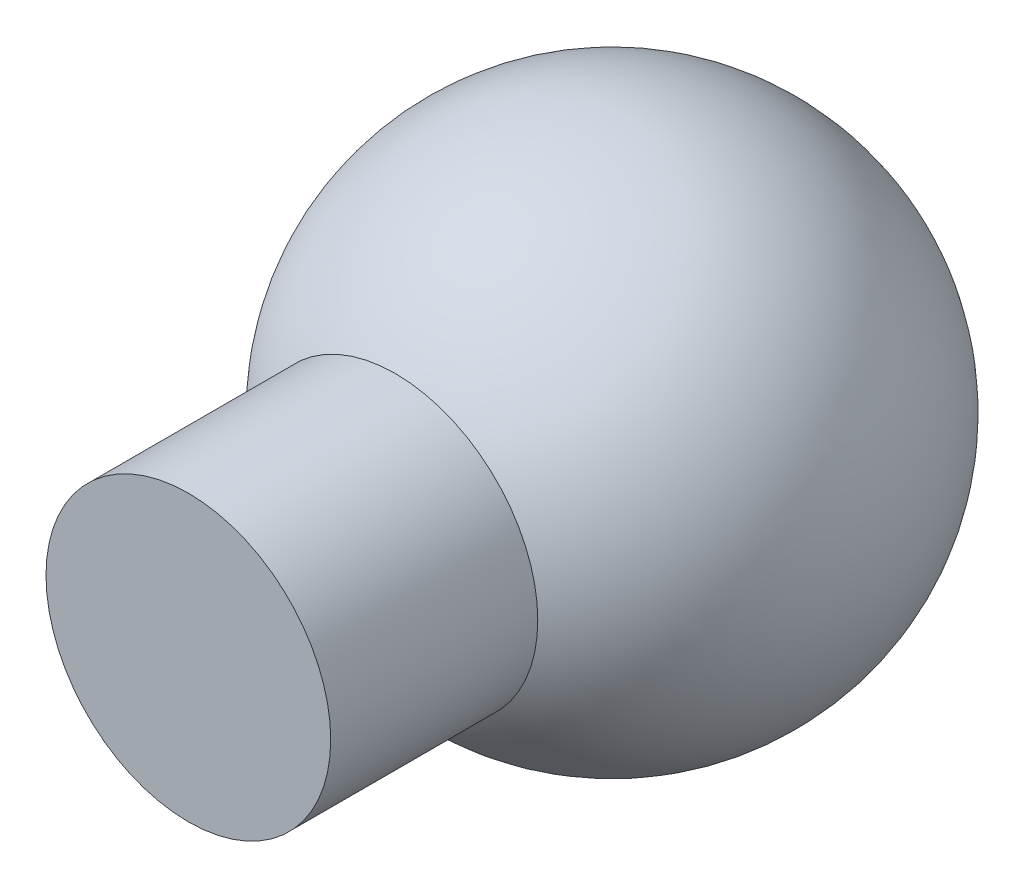
from build123d import *

# Parameters (mm, degrees)
SKETCH_1_R          = 5.5
EXTRUDE_1_DEPTH     = 15
SKETCH_3_R          = 7.159544481
CUT_EXTRUDE_1_DEPTH = 7


with BuildPart() as part:
    # 스케치1 → 보스-돌출1 (new body)
    with BuildSketch(Plane.XY):
        Circle(SKETCH_1_R)
    extrude(amount=EXTRUDE_1_DEPTH)

    # 스케치2 → 회전1 (revolve)
    with BuildSketch(Plane(origin=(0, 0, 0), x_dir=(1, 0, 0), z_dir=(0, 1, 0)), mode=Mode.PRIVATE) as revolve_1_sk:
        with BuildLine():
            Line((0, 18.371801754), (0, 0))
            Line((0, 0), (-5.469271925, 0))
            ThreePointArc((-5.469271925, 0), (-9.584310553, 11.225043985), (0, 18.371801754))
        make_face()
    revolve(revolve_1_sk.sketch.rotate(Axis((0, 0, -18.371801754), (0, 0, 1)), 180), axis=Axis((0, 0, -18.371801754), (0, 0, 1)))

    # 스케치3 → 컷-돌출1 (cut)
    with BuildSketch(Plane.XY.offset(15)):
        Circle(SKETCH_3_R)
    extrude(amount=-CUT_EXTRUDE_1_DEPTH, mode=Mode.SUBTRACT)


solid = part.part
